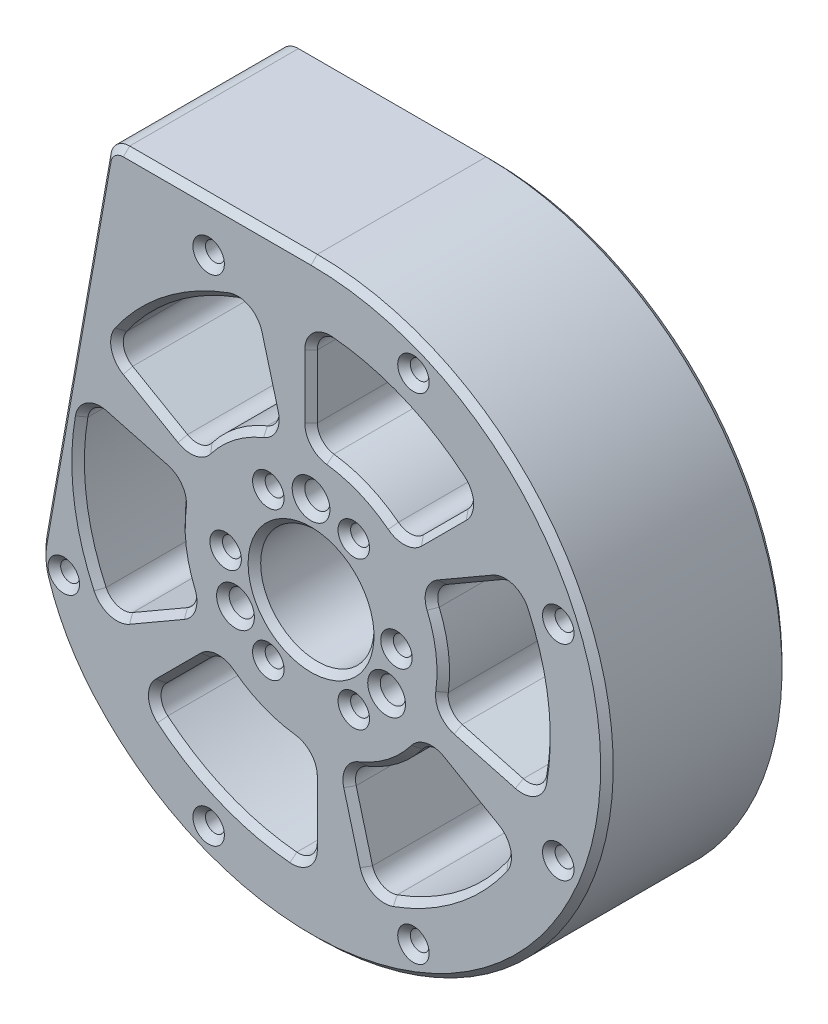
from build123d import *

# Parameters (mm, degrees)
SKETCH_1_R      = 1.5
SKETCH_1_R_2    = 9
SKETCH_1_R_3    = 2
EXTRUDE_1_DEPTH = 28.8
CHAMFER_1_SIZE  = 1


with BuildPart() as part:
    # 草图1 → 凸台-拉伸1 (new body)
    with BuildSketch(Plane.XY):
        with BuildLine():
            Line((-29.803930183, 47), (0, 47))
            ThreePointArc((0, 47), (42.818948099, -19.378794691), (-35.309770387, -31.019673035))
            ThreePointArc((-35.309770387, -31.019673035), (-39.640377342, -24.925220323), (-42.632593318, -18.073712897))
            ThreePointArc((-42.632593318, -18.073712897), (-43.082920276, -15.705652165), (-42.953504379, -13.298629622))
            Line((-42.953504379, -13.298629622), (-32.758353443, 44.520944533))
            ThreePointArc((-32.758353443, 44.520944533), (-31.732293013, 46.298133329), (-29.803930183, 47))
        make_face()
        with Locations((16.264045876, 39.264880132)):
            Circle(SKETCH_1_R, mode=Mode.SUBTRACT)
        with Locations((-16.264045876, 39.264880132)):
            Circle(SKETCH_1_R, mode=Mode.SUBTRACT)
        with Locations((-39.264880132, -16.264045876)):
            Circle(SKETCH_1_R, mode=Mode.SUBTRACT)
        with Locations((-16.264045876, -39.264880132)):
            Circle(SKETCH_1_R, mode=Mode.SUBTRACT)
        with Locations((16.264045876, -39.264880132)):
            Circle(SKETCH_1_R, mode=Mode.SUBTRACT)
        with Locations((39.264880132, -16.264045876)):
            Circle(SKETCH_1_R, mode=Mode.SUBTRACT)
        with Locations((39.264880132, 16.264045876)):
            Circle(SKETCH_1_R, mode=Mode.SUBTRACT)
        Circle(SKETCH_1_R_2, mode=Mode.SUBTRACT)
        with Locations((-6.783865663, 11.75)):
            Circle(SKETCH_1_R, mode=Mode.SUBTRACT)
        with Locations((6.783865663, 11.75)):
            Circle(SKETCH_1_R, mode=Mode.SUBTRACT)
        with Locations((-13.567731326, 0)):
            Circle(SKETCH_1_R, mode=Mode.SUBTRACT)
        with Locations((-6.783865663, -11.75)):
            Circle(SKETCH_1_R, mode=Mode.SUBTRACT)
        with Locations((6.783865663, -11.75)):
            Circle(SKETCH_1_R, mode=Mode.SUBTRACT)
        with Locations((13.567731326, 0)):
            Circle(SKETCH_1_R, mode=Mode.SUBTRACT)
        with Locations((0, 13.856406461)):
            Circle(SKETCH_1_R_3, mode=Mode.SUBTRACT)
        with Locations((12, -6.92820323)):
            Circle(SKETCH_1_R_3, mode=Mode.SUBTRACT)
        with Locations((-12, -6.92820323)):
            Circle(SKETCH_1_R_3, mode=Mode.SUBTRACT)
        with BuildLine():
            Line((0, 23.8117618), (0, 33.867388444))
            ThreePointArc((0, 33.867388444), (0.974428185, 36.080318362), (3.264705882, 36.855687424))
            ThreePointArc((3.264705882, 36.855687424), (14.159286998, 34.183542703), (23.752410835, 28.369402171))
            ThreePointArc((23.752410835, 28.369402171), (24.823613004, 26.201662559), (23.94786003, 23.94786003))
            Line((23.94786003, 23.94786003), (16.83745824, 16.83745824))
            ThreePointArc((16.83745824, 16.83745824), (14.904006635, 15.964666806), (12.87662066, 16.588931261))
            ThreePointArc((12.87662066, 16.588931261), (8.03635208, 19.401470183), (2.625, 20.835291575))
            ThreePointArc((2.625, 20.835291575), (0.75, 21.827448316), (0, 23.8117618))
        make_face(mode=Mode.SUBTRACT)
        with BuildLine():
            Line((20.621590627, 11.9058809), (29.330018752, 16.933694222))
            ThreePointArc((29.330018752, 16.933694222), (31.733686371, 17.196279618), (33.550314524, 15.600525482))
            ThreePointArc((33.550314524, 15.600525482), (36.683459871, 4.829469112), (36.444828388, -6.385490099))
            ThreePointArc((36.444828388, -6.385490099), (35.103111899, -8.397048195), (32.713385167, -8.765525137))
            Line((32.713385167, -8.765525137), (23.000395692, -6.162937451))
            ThreePointArc((23.000395692, -6.162937451), (21.277810335, -4.924914961), (20.804746224, -2.857014976))
            ThreePointArc((20.804746224, -2.857014976), (20.820342089, 2.741050037), (19.356391799, 8.144329102))
            ThreePointArc((19.356391799, 8.144329102), (19.278124742, 10.264205105), (20.621590627, 11.9058809))
        make_face(mode=Mode.SUBTRACT)
        with BuildLine():
            Line((20.621590627, -11.9058809), (29.330018752, -16.933694222))
            ThreePointArc((29.330018752, -16.933694222), (30.759258186, -18.884038744), (30.285608642, -21.255161942))
            ThreePointArc((30.285608642, -21.255161942), (22.524172873, -29.354073591), (12.692417553, -34.75489227))
            ThreePointArc((12.692417553, -34.75489227), (10.279498896, -34.598710754), (8.765525137, -32.713385167))
            Line((8.765525137, -32.713385167), (6.162937451, -23.000395692))
            ThreePointArc((6.162937451, -23.000395692), (6.3738037, -20.889581767), (7.928125564, -19.445946237))
            ThreePointArc((7.928125564, -19.445946237), (12.783990009, -16.660420146), (16.731391799, -12.690962472))
            ThreePointArc((16.731391799, -12.690962472), (18.528124742, -11.563243211), (20.621590627, -11.9058809))
        make_face(mode=Mode.SUBTRACT)
        with BuildLine():
            Line((0, -23.8117618), (0, -33.867388444))
            ThreePointArc((0, -33.867388444), (-0.974428185, -36.080318362), (-3.264705882, -36.855687424))
            ThreePointArc((-3.264705882, -36.855687424), (-14.159286998, -34.183542703), (-23.752410835, -28.369402171))
            ThreePointArc((-23.752410835, -28.369402171), (-24.823613004, -26.201662559), (-23.94786003, -23.94786003))
            Line((-23.94786003, -23.94786003), (-16.83745824, -16.83745824))
            ThreePointArc((-16.83745824, -16.83745824), (-14.904006635, -15.964666806), (-12.87662066, -16.588931261))
            ThreePointArc((-12.87662066, -16.588931261), (-8.03635208, -19.401470183), (-2.625, -20.835291575))
            ThreePointArc((-2.625, -20.835291575), (-0.75, -21.827448316), (0, -23.8117618))
        make_face(mode=Mode.SUBTRACT)
        with BuildLine():
            Line((-20.621590627, -11.9058809), (-29.330018752, -16.933694222))
            ThreePointArc((-29.330018752, -16.933694222), (-31.733686371, -17.196279618), (-33.550314524, -15.600525482))
            ThreePointArc((-33.550314524, -15.600525482), (-36.683459871, -4.829469112), (-36.444828388, 6.385490099))
            ThreePointArc((-36.444828388, 6.385490099), (-35.103111899, 8.397048195), (-32.713385167, 8.765525137))
            Line((-32.713385167, 8.765525137), (-23.000395692, 6.162937451))
            ThreePointArc((-23.000395692, 6.162937451), (-21.277810335, 4.924914961), (-20.804746224, 2.857014976))
            ThreePointArc((-20.804746224, 2.857014976), (-20.820342089, -2.741050037), (-19.356391799, -8.144329102))
            ThreePointArc((-19.356391799, -8.144329102), (-19.278124742, -10.264205105), (-20.621590627, -11.9058809))
        make_face(mode=Mode.SUBTRACT)
        with BuildLine():
            Line((-20.621590627, 11.9058809), (-29.330018752, 16.933694222))
            ThreePointArc((-29.330018752, 16.933694222), (-30.759258186, 18.884038744), (-30.285608642, 21.255161942))
            ThreePointArc((-30.285608642, 21.255161942), (-22.524172873, 29.354073591), (-12.692417553, 34.75489227))
            ThreePointArc((-12.692417553, 34.75489227), (-10.279498896, 34.598710754), (-8.765525137, 32.713385167))
            Line((-8.765525137, 32.713385167), (-6.162937451, 23.000395692))
            ThreePointArc((-6.162937451, 23.000395692), (-6.3738037, 20.889581767), (-7.928125564, 19.445946237))
            ThreePointArc((-7.928125564, 19.445946237), (-12.783990009, 16.660420146), (-16.731391799, 12.690962472))
            ThreePointArc((-16.731391799, 12.690962472), (-18.528124742, 11.563243211), (-20.621590627, 11.9058809))
        make_face(mode=Mode.SUBTRACT)
    extrude(amount=EXTRUDE_1_DEPTH)

    # 倒角1
    chamfer_1_edges = [part.edges().sort_by_distance(p)[0] for p in [
        (31.733686371, 17.196279618, 0),
        (24.97580469, 14.419787561, 0),
        (19.278124742, 10.264205105, 0),
        (20.820342089, 2.741050037, 0),
        (21.277810335, -4.924914961, 0),
        (27.856890429, -7.464231294, 0),
        (35.103111899, -8.397048195, 0),
        (36.683459871, 4.829469112, 0),
        (31.733686371, 17.196279618, 28.8),
        (24.97580469, 14.419787561, 28.8),
        (19.278124742, 10.264205105, 28.8),
        (20.820342089, 2.741050037, 28.8),
        (21.277810335, -4.924914961, 28.8),
        (27.856890429, -7.464231294, 28.8),
        (35.103111899, -8.397048195, 28.8),
        (36.683459871, 4.829469112, 28.8),
        (-31.732293013, 46.298133329, 28.8),
        (30.759258186, -18.884038744, 0),
        (24.97580469, -14.419787561, 0),
        (18.528124742, -11.563243211, 0),
        (12.783990009, -16.660420146, 0),
        (6.3738037, -20.889581767, 0),
        (7.464231294, -27.856890429, 0),
        (10.279498896, -34.598710754, 0),
        (22.524172873, -29.354073591, 0),
        (30.759258186, -18.884038744, 28.8),
        (24.97580469, -14.419787561, 28.8),
        (18.528124742, -11.563243211, 28.8),
        (12.783990009, -16.660420146, 28.8),
        (6.3738037, -20.889581767, 28.8),
        (7.464231294, -27.856890429, 28.8),
        (10.279498896, -34.598710754, 28.8),
        (22.524172873, -29.354073591, 28.8),
        (-0.974428185, -36.080318362, 0),
        (0, -28.839575122, 0),
        (-0.75, -21.827448316, 0),
        (-8.03635208, -19.401470183, 0),
        (-14.904006635, -15.964666806, 0),
        (-20.392659135, -20.392659135, 0),
        (-24.823613004, -26.201662559, 0),
        (-14.159286998, -34.183542703, 0),
        (-0.974428185, -36.080318362, 28.8),
        (0, -28.839575122, 28.8),
        (-0.75, -21.827448316, 28.8),
        (-8.03635208, -19.401470183, 28.8),
        (-14.904006635, -15.964666806, 28.8),
        (-20.392659135, -20.392659135, 28.8),
        (-24.823613004, -26.201662559, 28.8),
        (-14.159286998, -34.183542703, 28.8),
        (-37.855928911, 15.611157455, 28.8),
        (14.764045876, 39.264880132, 0),
        (14.764045876, 39.264880132, 28.8),
        (-31.733686371, -17.196279618, 0),
        (-24.97580469, -14.419787561, 0),
        (-19.278124742, -10.264205105, 0),
        (-20.820342089, -2.741050037, 0),
        (-21.277810335, 4.924914961, 0),
        (-27.856890429, 7.464231294, 0),
        (-35.103111899, 8.397048195, 0),
        (-36.683459871, -4.829469112, 0),
        (-31.733686371, -17.196279618, 28.8),
        (-24.97580469, -14.419787561, 28.8),
        (-19.278124742, -10.264205105, 28.8),
        (-20.820342089, -2.741050037, 28.8),
        (-21.277810335, 4.924914961, 28.8),
        (-27.856890429, 7.464231294, 28.8),
        (-35.103111899, 8.397048195, 28.8),
        (-36.683459871, -4.829469112, 28.8),
        (-30.759258186, 18.884038744, 0),
        (-24.97580469, 14.419787561, 0),
        (-18.528124742, 11.563243211, 0),
        (-12.783990009, 16.660420146, 0),
        (-6.3738037, 20.889581767, 0),
        (-7.464231294, 27.856890429, 0),
        (-17.764045876, 39.264880132, 0),
        (-10.279498896, 34.598710754, 0),
        (-22.524172873, 29.354073591, 0),
        (-30.759258186, 18.884038744, 28.8),
        (-43.082920276, -15.705652165, 28.8),
        (-24.97580469, 14.419787561, 28.8),
        (-18.528124742, 11.563243211, 28.8),
        (-12.783990009, 16.660420146, 28.8),
        (-6.3738037, 20.889581767, 28.8),
        (-7.464231294, 27.856890429, 28.8),
        (-10.279498896, 34.598710754, 28.8),
        (-17.764045876, 39.264880132, 28.8),
        (-22.524172873, 29.354073591, 28.8),
        (-40.764880132, -16.264045876, 0),
        (-39.640377342, -24.925220323, 28.8),
        (-40.764880132, -16.264045876, 28.8),
        (-17.764045876, -39.264880132, 0),
        (-17.764045876, -39.264880132, 28.8),
        (14.764045876, -39.264880132, 0),
        (14.764045876, -39.264880132, 28.8),
        (37.764880132, -16.264045876, 0),
        (37.764880132, -16.264045876, 28.8),
        (37.764880132, 16.264045876, 0),
        (37.764880132, 16.264045876, 28.8),
        (-9, 0, 0),
        (-9, 0, 28.8),
        (-8.283865663, 11.75, 0),
        (-8.283865663, 11.75, 28.8),
        (42.818948099, -19.378794691, 28.8),
        (5.283865663, 11.75, 0),
        (5.283865663, 11.75, 28.8),
        (-15.067731326, 0, 0),
        (-15.067731326, 0, 28.8),
        (-8.283865663, -11.75, 0),
        (-8.283865663, -11.75, 28.8),
        (5.283865663, -11.75, 0),
        (5.283865663, -11.75, 28.8),
        (12.067731326, 0, 0),
        (12.067731326, 0, 28.8),
        (-39.640377342, -24.925220323, 0),
        (-2, 13.856406461, 0),
        (-2, 13.856406461, 28.8),
        (-43.082920276, -15.705652165, 0),
        (10, -6.92820323, 0),
        (10, -6.92820323, 28.8),
        (-37.855928911, 15.611157455, 0),
        (-14, -6.92820323, 0),
        (-14, -6.92820323, 28.8),
        (-31.732293013, 46.298133329, 0),
        (-14.901965092, 47, 0),
        (0.974428185, 36.080318362, 0),
        (42.818948099, -19.378794691, 0),
        (0, 28.839575122, 0),
        (0.75, 21.827448316, 0),
        (8.03635208, 19.401470183, 0),
        (14.904006635, 15.964666806, 0),
        (20.392659135, 20.392659135, 0),
        (-14.901965092, 47, 28.8),
        (24.823613004, 26.201662559, 0),
        (14.159286998, 34.183542703, 0),
        (0.974428185, 36.080318362, 28.8),
        (0, 28.839575122, 28.8),
        (0.75, 21.827448316, 28.8),
        (8.03635208, 19.401470183, 28.8),
        (14.904006635, 15.964666806, 28.8),
        (20.392659135, 20.392659135, 28.8),
        (24.823613004, 26.201662559, 28.8),
        (14.159286998, 34.183542703, 28.8),
    ]]
    chamfer(chamfer_1_edges, length=CHAMFER_1_SIZE)


solid = part.part
